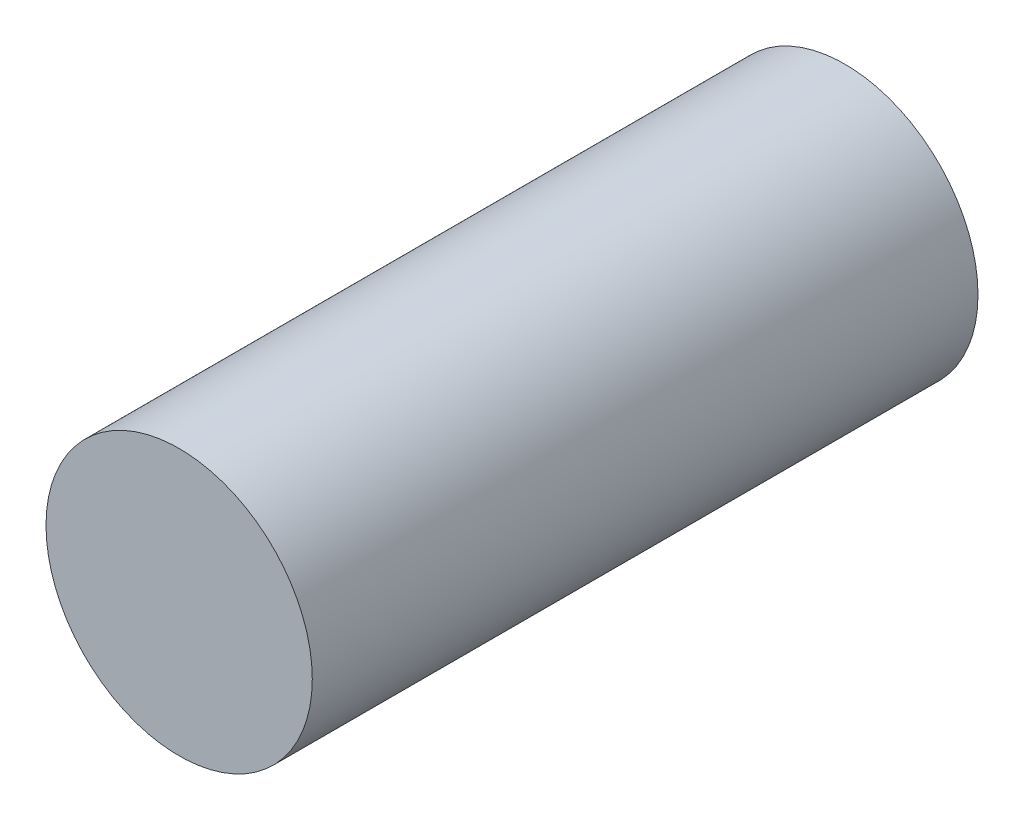
from build123d import *

# Parameters (mm, degrees)
SKETCH_1_R      = 3
EXTRUDE_1_DEPTH = 15


with BuildPart() as part:
    # 草图1 → 凸台-拉伸1 (new body)
    with BuildSketch(Plane.XY):
        Circle(SKETCH_1_R)
    extrude(amount=EXTRUDE_1_DEPTH)


solid = part.part
